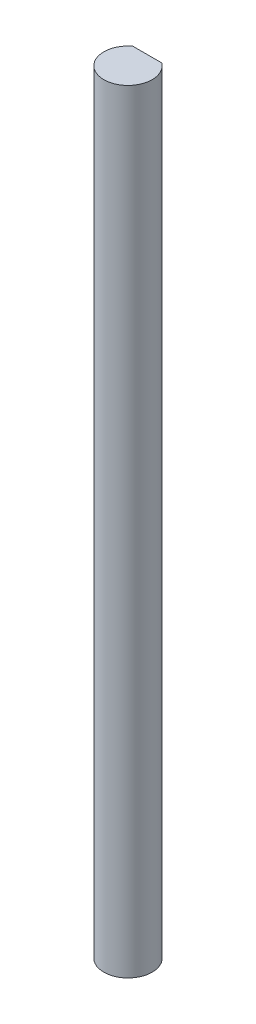
from build123d import *

# Parameters (mm, degrees)
SKETCH1_R           = 3.175
BOSS_EXTRUDE1_DEPTH = 101.6
CUT_EXTRUDE1_DEPTH  = 102.699170351


with BuildPart() as part:
    # Sketch1 → Boss-Extrude1 (new body)
    with BuildSketch(Plane(origin=(0, 0, 0), x_dir=(1, 0, 0), z_dir=(0, 1, 0))):
        with Locations(Location((0, 0, 0), (0, 0, 270))):
            Circle(SKETCH1_R)
    extrude(amount=BOSS_EXTRUDE1_DEPTH)

    # Sketch2 → Cut-Extrude1 (cut, through all)
    with BuildSketch(Plane.XZ):
        with BuildLine():
            Line((1.905, -2.54), (-1.905, -2.54))
            ThreePointArc((-1.905, -2.54), (0, -3.175), (1.905, -2.54))
        make_face()
    extrude(amount=-CUT_EXTRUDE1_DEPTH, mode=Mode.SUBTRACT)


solid = part.part
